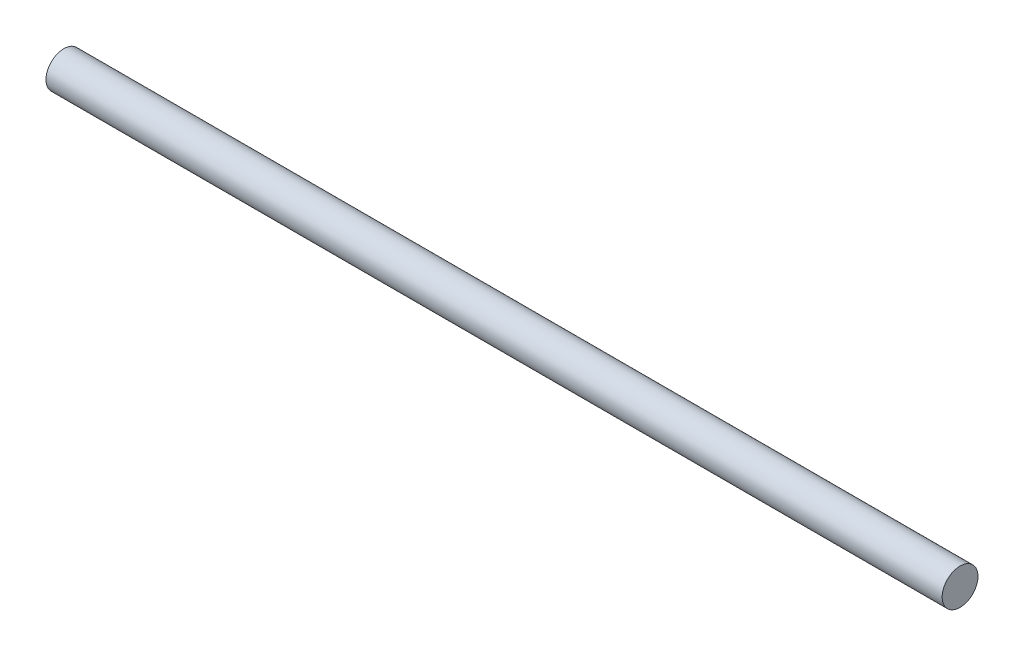
from build123d import *

# Parameters (mm, degrees)
SKETCH_1_R      = 2
EXTRUDE_1_DEPTH = 100


with BuildPart() as part:
    # 草图1 → 凸台-拉伸1 (new body)
    with BuildSketch(Plane(origin=(0, 0, 0), x_dir=(0, 0, -1), z_dir=(1, 0, 0))):
        Circle(SKETCH_1_R)
    extrude(amount=EXTRUDE_1_DEPTH)


solid = part.part
